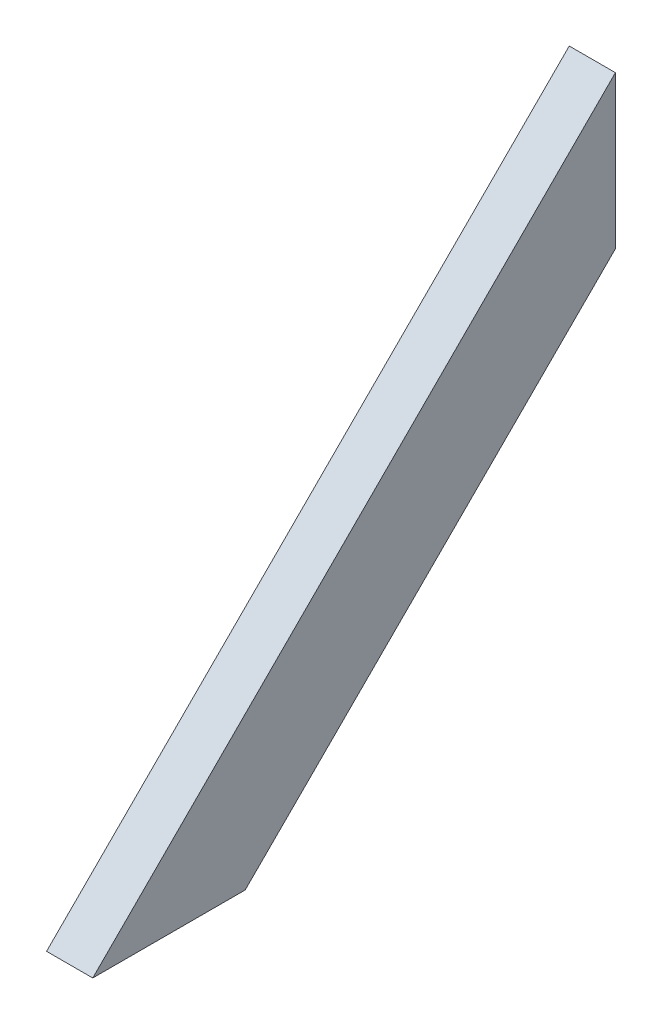
from build123d import *

# Parameters (mm, degrees)
BOSS_EXTRUDE1_DEPTH = 38.1


with BuildPart() as part:
    # Sketch1 → Boss-Extrude1 (new body)
    with BuildSketch(Plane(origin=(0, 0, 0), x_dir=(0, 0, -1), z_dir=(1, 0, 0))):
        Polygon((0, 0), (125.723585695, 0), (431.052293811, 305.328708116), (431.052293811, 431.052293811), align=None)
    extrude(amount=BOSS_EXTRUDE1_DEPTH)


solid = part.part
